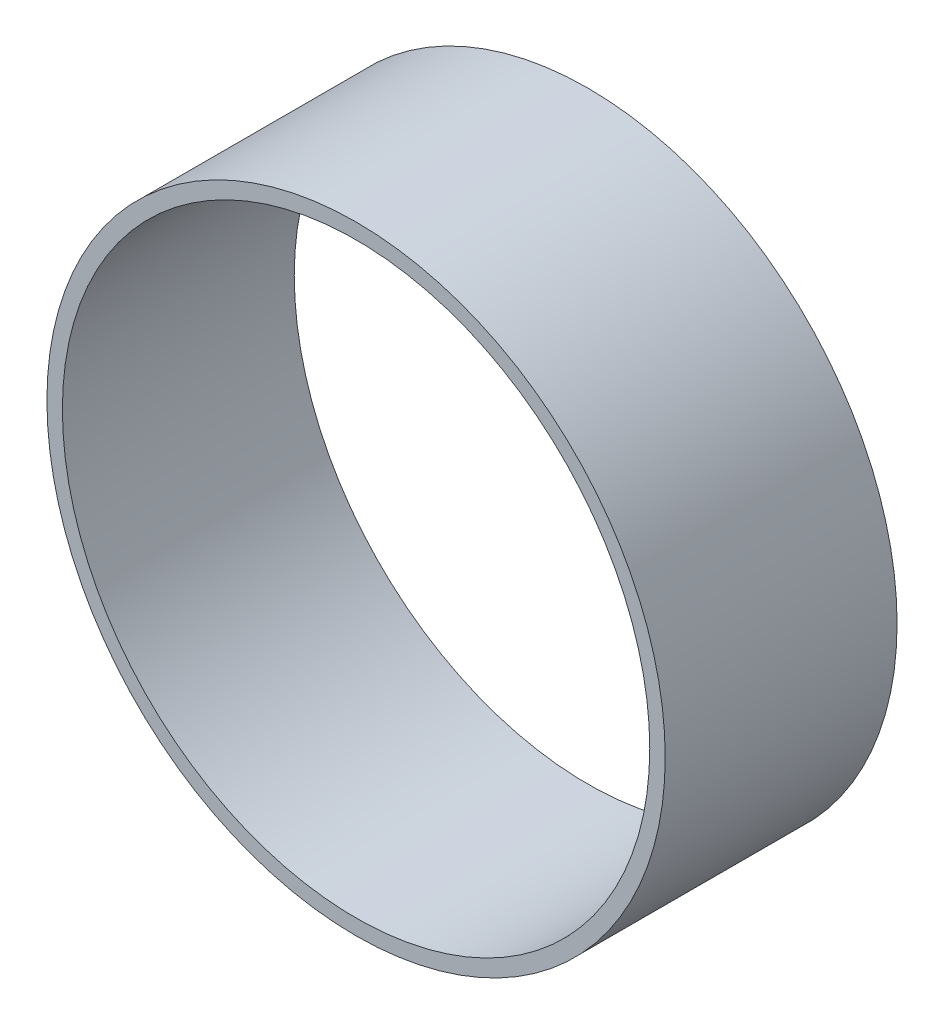
from build123d import *

# Parameters (mm, degrees)
SKETCH_1_R      = 40
SKETCH_1_R_2    = 38
EXTRUDE_1_DEPTH = 30


with BuildPart() as part:
    # 草图1 → 凸台-拉伸1 (new body)
    with BuildSketch(Plane.XY):
        Circle(SKETCH_1_R)
        Circle(SKETCH_1_R_2, mode=Mode.SUBTRACT)
    extrude(amount=EXTRUDE_1_DEPTH)


solid = part.part
